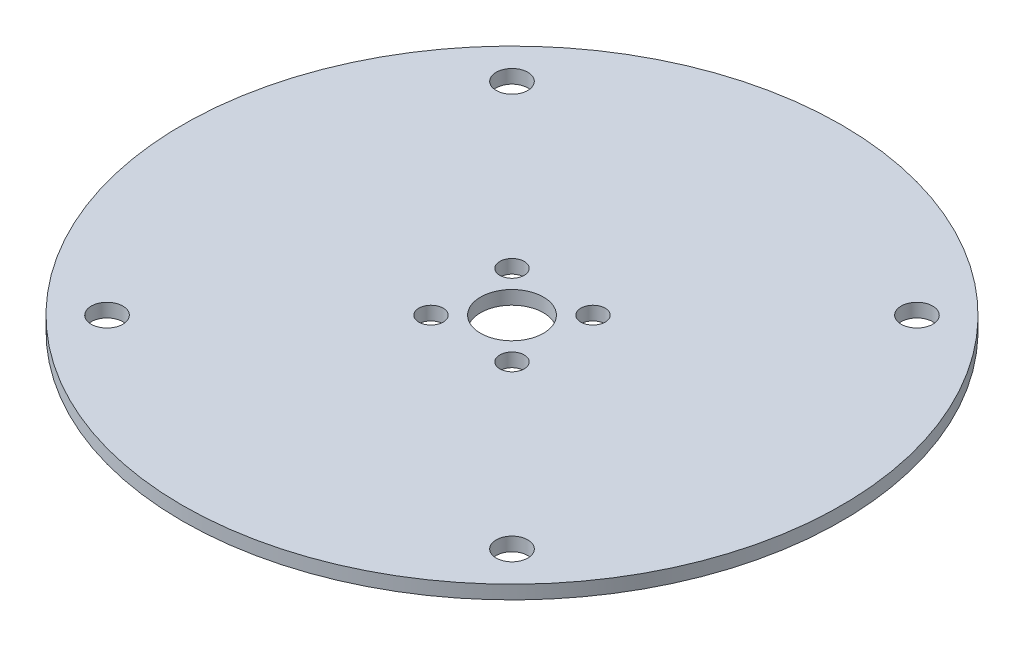
from build123d import *

# Parameters (mm, degrees)
SKETCH1_R           = 40.69
SKETCH1_R_2         = 1.95
SKETCH1_R_3         = 1.5
SKETCH1_R_4         = 3.88
BOSS_EXTRUDE1_DEPTH = 1.68


with BuildPart() as part:
    # Sketch1 → Boss-Extrude1 (new body)
    with BuildSketch(Plane(origin=(0, 0, 0), x_dir=(1, 0, 0), z_dir=(0, 1, 0))):
        with Locations(Location((0, 0, 0), (0, 0, 270))):
            Circle(SKETCH1_R)
        with Locations(Location((-25, 25, 0), (0, 0, 270))):
            Circle(SKETCH1_R_2, mode=Mode.SUBTRACT)
        with Locations(Location((25, 25, 0), (0, 0, 270))):
            Circle(SKETCH1_R_2, mode=Mode.SUBTRACT)
        with Locations(Location((25, -25, 0), (0, 0, 270))):
            Circle(SKETCH1_R_2, mode=Mode.SUBTRACT)
        with Locations(Location((-25, -25, 0), (0, 0, 270))):
            Circle(SKETCH1_R_2, mode=Mode.SUBTRACT)
        with Locations(Location((-5, 5, 0), (0, 0, 270))):
            Circle(SKETCH1_R_3, mode=Mode.SUBTRACT)
        with Locations(Location((5, 5, 0), (0, 0, 270))):
            Circle(SKETCH1_R_3, mode=Mode.SUBTRACT)
        with Locations(Location((5, -5, 0), (0, 0, 270))):
            Circle(SKETCH1_R_3, mode=Mode.SUBTRACT)
        with Locations(Location((-5, -5, 0), (0, 0, 270))):
            Circle(SKETCH1_R_3, mode=Mode.SUBTRACT)
        with Locations(Location((0, 0, 0), (0, 0, 270))):
            Circle(SKETCH1_R_4, mode=Mode.SUBTRACT)
    extrude(amount=BOSS_EXTRUDE1_DEPTH)


solid = part.part
